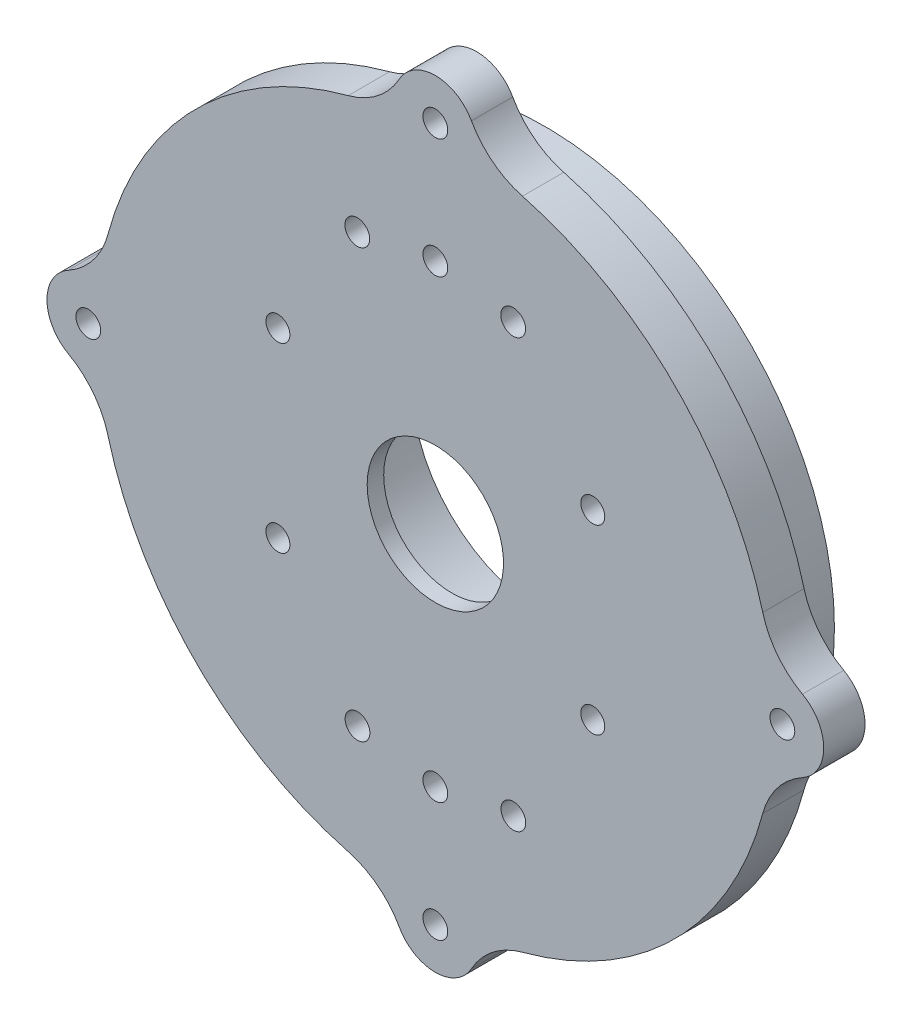
from build123d import *

# Parameters (mm, degrees)
IZIM1_R                       = 22.5
IZIM1_R_2                     = 16.1
Y_KSEKLIK_EKSTR_ZYON1_DEPTH   = 8.25
IZIM1_R_3                     = 35.05
IZIM1_R_4                     = 31
Y_KSEKLIK_EKSTR_ZYON1_2_DEPTH = 8.25
IZIM2_R                       = 1.5
IZIM2_R_2                     = 7.15
Y_KSEKLIK_EKSTR_ZYON2_DEPTH   = 5
IZIM7_R                       = 16.1
KES_EKSTR_ZYON2_DEPTH         = 1
IZIM8_R                       = 8.25
KES_EKSTR_ZYON3_DEPTH         = 4
KES_EKSTR_ZYON4_REACH         = 69.776
IZIM9_R                       = 1.45
IZIM10_R                      = 1.5
KES_EKSTR_ZYON5_DEPTH         = 5
IZIM11_R                      = 12.5
KES_EKSTR_ZYON6_DEPTH         = 2


with BuildPart() as part:
    # Çizim1 → Yükseklik-Ekstrüzyon1 (new body)
    with BuildSketch(Plane.XY):
        Circle(IZIM1_R)
        Circle(IZIM1_R_2, mode=Mode.SUBTRACT)
    extrude(amount=Y_KSEKLIK_EKSTR_ZYON1_DEPTH)



with BuildPart() as body_2:
    # Çizim1 → Y_kseklik-Ekstr_zyon1 2 (new body)
    with BuildSketch(Plane.XY):
        Circle(IZIM1_R_3)
        Circle(IZIM1_R_4, mode=Mode.SUBTRACT)
    extrude(amount=Y_KSEKLIK_EKSTR_ZYON1_2_DEPTH)


with BuildPart() as part_1:
    add(part.part)

    add(body_2.part)  # Yükseklik-Ekstrüzyon2 merges body 2
    # Çizim2 → Yükseklik-Ekstrüzyon2 (add)
    with BuildSketch(Plane.XY.offset(8.25)):
        with BuildLine():
            ThreePointArc((-10.540830255, 39.621848739), (-28.991378029, 28.991378029), (-39.621848739, 10.540830255))
            ThreePointArc((-39.621848739, 10.540830255), (-41.396931543, 6.966269622), (-44.428571429, 4.370588155))
            ThreePointArc((-44.428571429, 4.370588155), (-47, 0), (-44.428571429, -4.370588155))
            ThreePointArc((-44.428571429, -4.370588155), (-41.396931543, -6.966269622), (-39.621848739, -10.540830255))
            ThreePointArc((-39.621848739, -10.540830255), (-28.991378029, -28.991378029), (-10.540830255, -39.621848739))
            ThreePointArc((-10.540830255, -39.621848739), (-6.966269622, -41.396931543), (-4.370588155, -44.428571429))
            ThreePointArc((-4.370588155, -44.428571429), (0, -47), (4.370588155, -44.428571429))
            ThreePointArc((4.370588155, -44.428571429), (6.966269622, -41.396931543), (10.540830255, -39.621848739))
            ThreePointArc((10.540830255, -39.621848739), (28.991378029, -28.991378029), (39.621848739, -10.540830255))
            ThreePointArc((39.621848739, -10.540830255), (41.396931543, -6.966269622), (44.428571429, -4.370588155))
            ThreePointArc((44.428571429, -4.370588155), (47, 0), (44.428571429, 4.370588155))
            ThreePointArc((44.428571429, 4.370588155), (41.396931543, 6.966269622), (39.621848739, 10.540830255))
            ThreePointArc((39.621848739, 10.540830255), (28.991378029, 28.991378029), (10.540830255, 39.621848739))
            ThreePointArc((10.540830255, 39.621848739), (6.966269622, 41.396931543), (4.370588155, 44.428571429))
            ThreePointArc((4.370588155, 44.428571429), (0, 47), (-4.370588155, 44.428571429))
            ThreePointArc((-4.370588155, 44.428571429), (-6.966269622, 41.396931543), (-10.540830255, 39.621848739))
        make_face()
        with Locations((0, 42)):
            Circle(IZIM2_R, mode=Mode.SUBTRACT)
        with Locations((42, 0)):
            Circle(IZIM2_R, mode=Mode.SUBTRACT)
        with Locations((0, -42)):
            Circle(IZIM2_R, mode=Mode.SUBTRACT)
        with Locations((-42, 0)):
            Circle(IZIM2_R, mode=Mode.SUBTRACT)
        Circle(IZIM2_R_2, mode=Mode.SUBTRACT)
    extrude(amount=Y_KSEKLIK_EKSTR_ZYON2_DEPTH)

    # Çizim7 → Kes-Ekstrüzyon2 (cut)
    with BuildSketch(Plane(origin=(0, 0, 8.25), x_dir=(-1, 0, 0), z_dir=(0, 0, -1))):
        Circle(IZIM7_R)
    extrude(amount=-KES_EKSTR_ZYON2_DEPTH, mode=Mode.SUBTRACT)

    # Çizim8 → Kes-Ekstrüzyon3 (cut)
    with BuildSketch(Plane(origin=(0, 0, 9.25), x_dir=(-1, 0, 0), z_dir=(0, 0, -1))):
        Circle(IZIM8_R)
    extrude(amount=-KES_EKSTR_ZYON3_DEPTH, mode=Mode.SUBTRACT)

    # Kes-Ekstrüzyon4: up to this face of the body (flat: up to its plane)
    kes_ekstr_zyon4_end = Plane(part_1.part.faces().sort_by_distance((-21.863603897, 0, 0))[0])
    # Çizim9 → Kes-Ekstrüzyon4 (cut, up to the picked face)
    with BuildSketch(Plane.XY.offset(13.25), mode=Mode.PRIVATE) as kes_ekstr_zyon4_sk1:
        with Locations((-19.052558883, 11)):
            Circle(IZIM9_R)
    kes_ekstr_zyon4_tool1 = split(extrude(kes_ekstr_zyon4_sk1.sketch, amount=-KES_EKSTR_ZYON4_REACH, mode=Mode.PRIVATE), bisect_by=kes_ekstr_zyon4_end, keep=Keep.BOTH, mode=Mode.PRIVATE)
    # Çizim9 → Kes-Ekstrüzyon4 (cut, up to the picked face)
    with BuildSketch(Plane.XY.offset(13.25), mode=Mode.PRIVATE) as kes_ekstr_zyon4_sk2:
        with Locations((19.052558883, -11)):
            Circle(IZIM9_R)
    kes_ekstr_zyon4_tool2 = split(extrude(kes_ekstr_zyon4_sk2.sketch, amount=-KES_EKSTR_ZYON4_REACH, mode=Mode.PRIVATE), bisect_by=kes_ekstr_zyon4_end, keep=Keep.BOTH, mode=Mode.PRIVATE)
    # Çizim9 → Kes-Ekstrüzyon4 (cut, up to the picked face)
    with BuildSketch(Plane.XY.offset(13.25), mode=Mode.PRIVATE) as kes_ekstr_zyon4_sk3:
        with Locations((19.052558883, 11)):
            Circle(IZIM9_R)
    kes_ekstr_zyon4_tool3 = split(extrude(kes_ekstr_zyon4_sk3.sketch, amount=-KES_EKSTR_ZYON4_REACH, mode=Mode.PRIVATE), bisect_by=kes_ekstr_zyon4_end, keep=Keep.BOTH, mode=Mode.PRIVATE)
    # Çizim9 → Kes-Ekstrüzyon4 (cut, up to the picked face)
    with BuildSketch(Plane.XY.offset(13.25), mode=Mode.PRIVATE) as kes_ekstr_zyon4_sk4:
        with Locations((-19.052558883, -11)):
            Circle(IZIM9_R)
    kes_ekstr_zyon4_tool4 = split(extrude(kes_ekstr_zyon4_sk4.sketch, amount=-KES_EKSTR_ZYON4_REACH, mode=Mode.PRIVATE), bisect_by=kes_ekstr_zyon4_end, keep=Keep.BOTH, mode=Mode.PRIVATE)
    add(kes_ekstr_zyon4_tool1.solids().sort_by(Axis((-19.052559, 11, 13.25), (0, 0, -1)))[0], mode=Mode.SUBTRACT)
    add(kes_ekstr_zyon4_tool2.solids().sort_by(Axis((19.052559, -11, 13.25), (0, 0, -1)))[0], mode=Mode.SUBTRACT)
    add(kes_ekstr_zyon4_tool3.solids().sort_by(Axis((19.052559, 11, 13.25), (0, 0, -1)))[0], mode=Mode.SUBTRACT)
    add(kes_ekstr_zyon4_tool4.solids().sort_by(Axis((-19.052559, -11, 13.25), (0, 0, -1)))[0], mode=Mode.SUBTRACT)

    # Çizim10 → Kes-Ekstrüzyon5 (cut)
    with BuildSketch(Plane(origin=(0, 0, 8.25), x_dir=(-1, 0, 0), z_dir=(0, 0, -1))):
        with Locations((0, 27.54309269)):
            Circle(IZIM10_R)
        with Locations((9.443282325, 25.873661779)):
            Circle(IZIM10_R)
        with Locations((-9.42029251, 25.882040955)):
            Circle(IZIM10_R)
        with Locations((9.42029251, -25.882040955)):
            Circle(IZIM10_R)
        with Locations((0, -27.54309269)):
            Circle(IZIM10_R)
        with Locations((-9.443282325, -25.873661779)):
            Circle(IZIM10_R)
    extrude(amount=-KES_EKSTR_ZYON5_DEPTH, mode=Mode.SUBTRACT)

    # Çizim11 → Kes-Ekstrüzyon6 (cut)
    with BuildSketch(Plane(origin=(0, 0, 9.25), x_dir=(-1, 0, 0), z_dir=(0, 0, -1))):
        Circle(IZIM11_R)
    extrude(amount=-KES_EKSTR_ZYON6_DEPTH, mode=Mode.SUBTRACT)


solid = part_1.part
